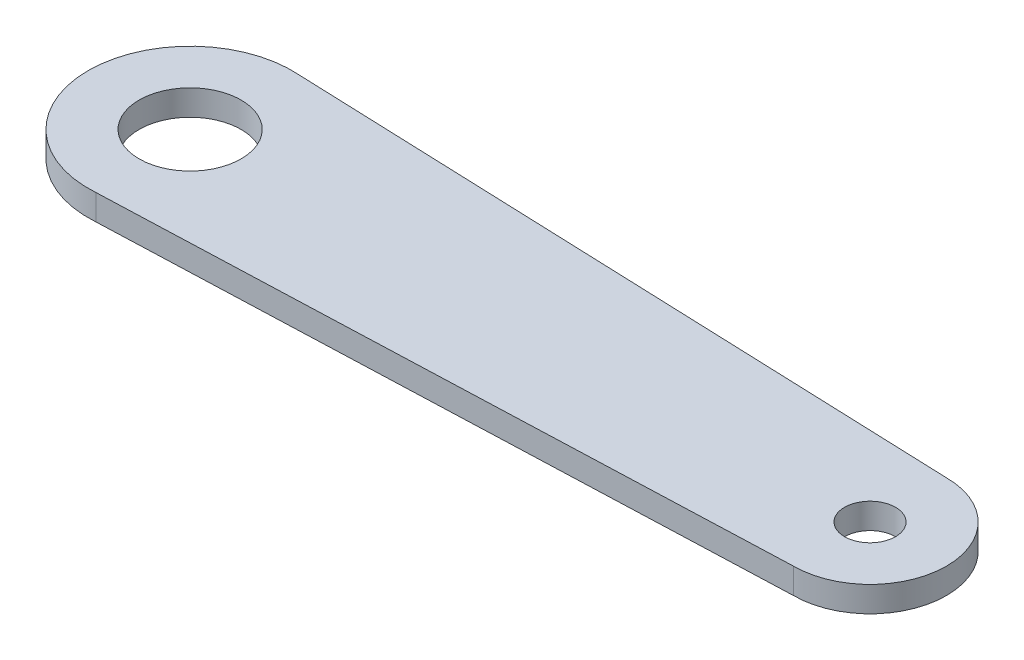
from build123d import *

# Parameters (mm, degrees)
BOSS_EXTRUDE1_DEPTH     = 1.5
CUT_EXTRUDE1_DEPTH      = 16
CUT_EXTRUDE1_DEPTH_BACK = 10.5
SKETCH2_R               = 3
SKETCH2_R_2             = 1.5


with BuildPart() as part:
    # Sketch1 → Boss-Extrude1 (new body)
    with BuildSketch(Plane(origin=(0, 0, 0), x_dir=(1, 0, 0), z_dir=(0, 1, 0))):
        with BuildLine():
            Line((0.449368076, 5.983148697), (40, 4.5))
            ThreePointArc((40, 4.5), (44.5, 0), (40, -4.5))
            Line((40, -4.5), (0.449368076, -5.983148697))
            ThreePointArc((0.449368076, -5.983148697), (-6, 0), (0.449368076, 5.983148697))
        make_face()
    extrude(amount=BOSS_EXTRUDE1_DEPTH)

    # Sketch2 → Cut-Extrude1 (cut, two sides: drawn at the far end of the back side and taken through both)
    with BuildSketch(Plane(origin=(0, 1.5, 0), x_dir=(1, 0, 0), z_dir=(0, 1, 0)).offset(-CUT_EXTRUDE1_DEPTH_BACK)):
        with Locations(Location((0, 0, 0), (0, 0, 270))):
            Circle(SKETCH2_R)
        with Locations(Location((40, 0, 0), (0, 0, 270))):
            Circle(SKETCH2_R_2)
    extrude(amount=CUT_EXTRUDE1_DEPTH + CUT_EXTRUDE1_DEPTH_BACK, mode=Mode.SUBTRACT)


solid = part.part
